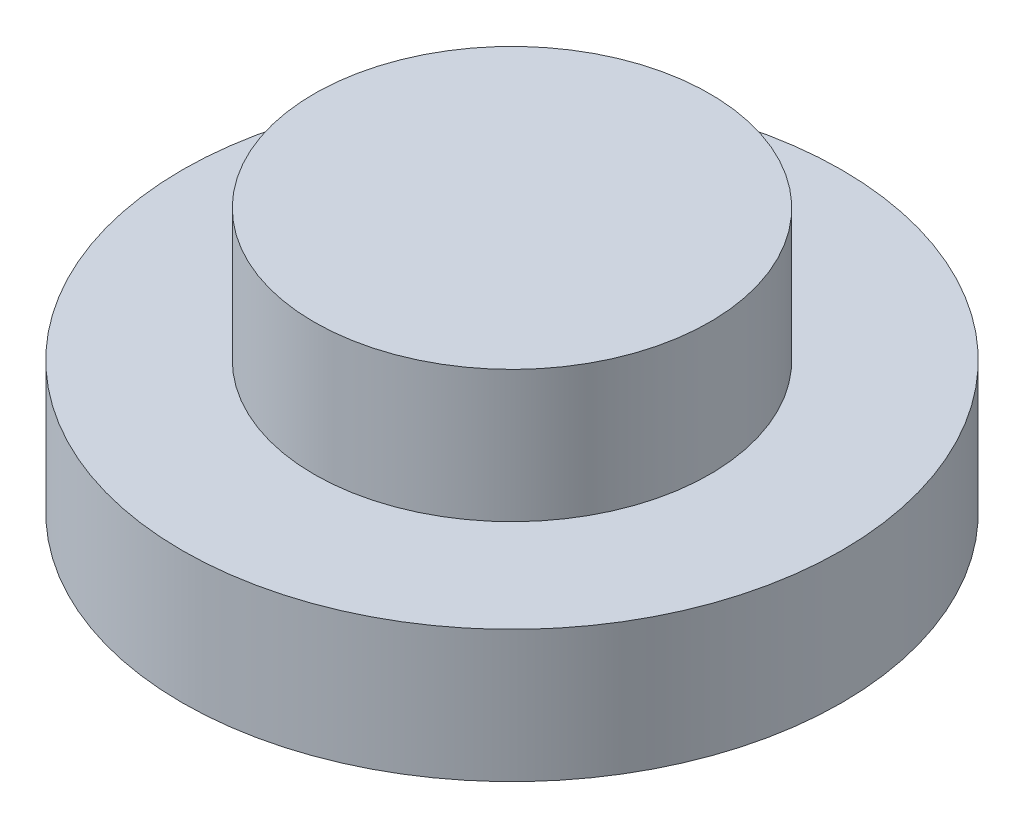
from build123d import *

# Parameters (mm, degrees)
SKETCH1_R           = 25
BOSS_EXTRUDE1_DEPTH = 10
SKETCH2_R           = 15
BOSS_EXTRUDE2_DEPTH = 10
SKETCH3_W           = 10
SKETCH3_H           = 10
BOSS_EXTRUDE3_DEPTH = 2


with BuildPart() as part:
    # Sketch1 → Boss-Extrude1 (new body)
    with BuildSketch(Plane(origin=(0, 0, 0), x_dir=(1, 0, 0), z_dir=(0, 1, 0))):
        with Locations(Location((0, 0, 0), (0, 0, 270))):
            Circle(SKETCH1_R)
    extrude(amount=BOSS_EXTRUDE1_DEPTH)

    # Sketch2 → Boss-Extrude2 (add)
    with BuildSketch(Plane(origin=(0, 10, 0), x_dir=(1, 0, 0), z_dir=(0, 1, 0))):
        with Locations(Location((0, 0, 0), (0, 0, 270))):
            Circle(SKETCH2_R)
    extrude(amount=BOSS_EXTRUDE2_DEPTH)

    # Sketch3 → Boss-Extrude3 (add)
    with BuildSketch(Plane.XZ):
        Rectangle(SKETCH3_W, SKETCH3_H)
    extrude(amount=BOSS_EXTRUDE3_DEPTH)


solid = part.part
